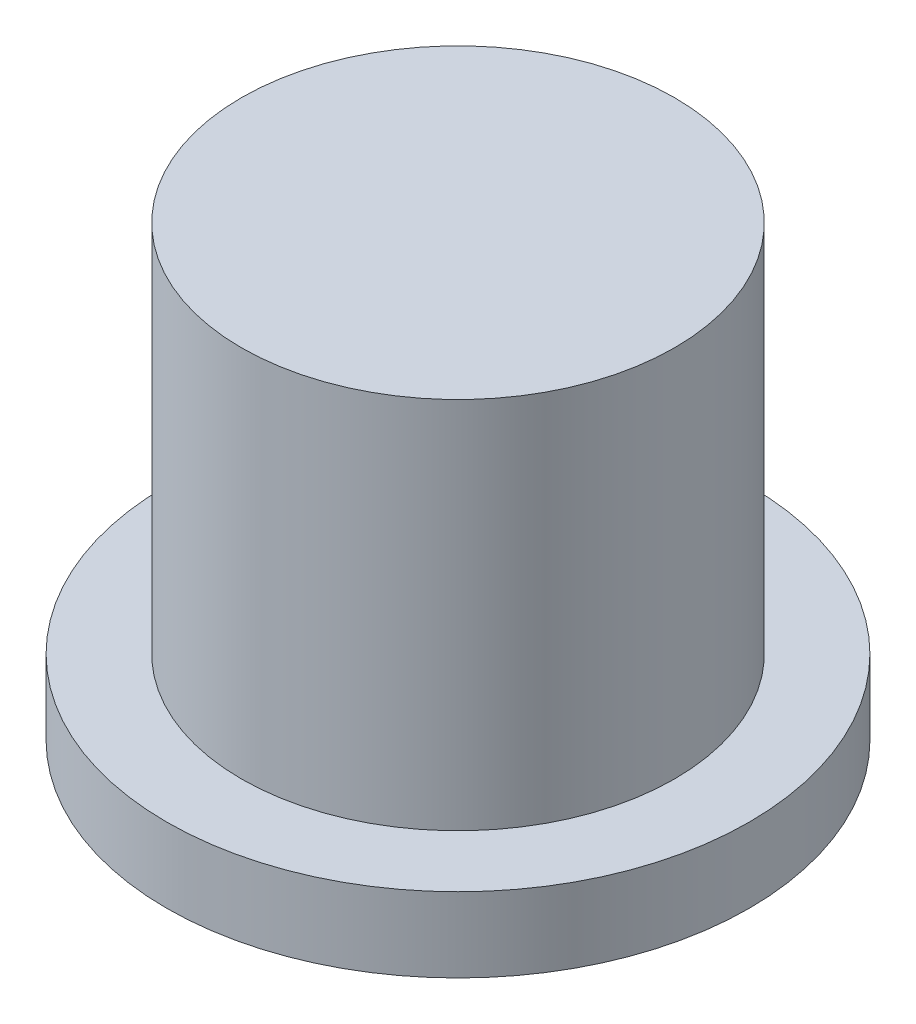
from build123d import *

# Parameters (mm, degrees)
SKETCH_1_R      = 2.9
SKETCH_1_R_2    = 1.9
EXTRUDE_1_DEPTH = 5
EXTRUDE_START   = 5
SKETCH_1_7_R    = 2.9
EXTRUDE_2_DEPTH = 1
SKETCH_1_8_R    = 3.9
SKETCH_1_8_R_2  = 1.9
EXTRUDE_3_DEPTH = 1


with BuildPart() as part:
    # 草图1 → 凸台-拉伸1 (new body)
    with BuildSketch(Plane(origin=(0, 0, 0), x_dir=(1, 0, 0), z_dir=(0, 1, 0))):
        with Locations(Location((0, 0, 0), (0, 0, 270))):
            Circle(SKETCH_1_R)
        with Locations(Location((0, 0, 0), (0, 0, 270))):
            Circle(SKETCH_1_R_2, mode=Mode.SUBTRACT)
    extrude(amount=EXTRUDE_1_DEPTH)

    # 草图1<7> → 凸台-拉伸2 (add)
    with BuildSketch(Plane(origin=(0, 0, 0), x_dir=(1, 0, 0), z_dir=(0, 1, 0)).offset(EXTRUDE_START)):
        with Locations(Location((0, 0, 0), (0, 0, 270))):
            Circle(SKETCH_1_7_R)
    extrude(amount=EXTRUDE_2_DEPTH)

    # 草图1<8> → 凸台-拉伸3 (add)
    with BuildSketch(Plane(origin=(0, 0, 0), x_dir=(1, 0, 0), z_dir=(0, 1, 0))):
        with Locations(Location((0, 0, 0), (0, 0, 270))):
            Circle(SKETCH_1_8_R)
        with Locations(Location((0, 0, 0), (0, 0, 270))):
            Circle(SKETCH_1_8_R_2, mode=Mode.SUBTRACT)
    extrude(amount=EXTRUDE_3_DEPTH)


solid = part.part
